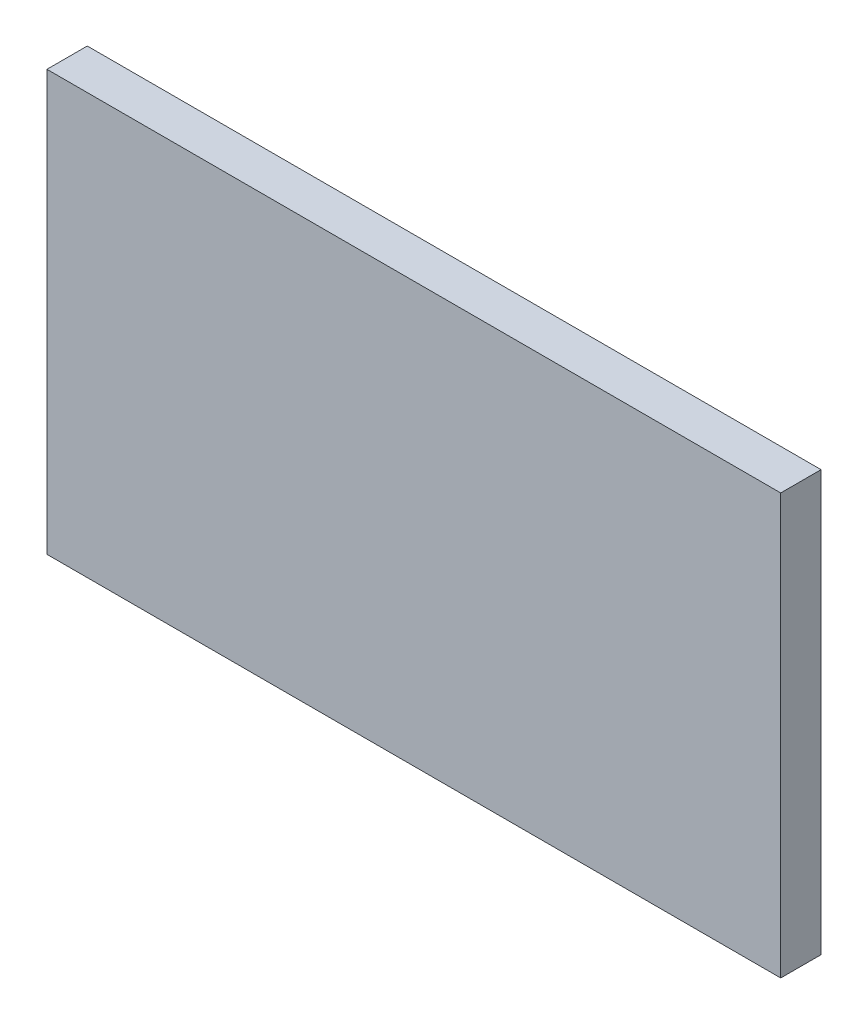
from build123d import *

# Parameters (mm, degrees)
SKETCH1_W           = 181.921942824
SKETCH1_H           = 104.149632438
BOSS_EXTRUDE1_DEPTH = 10


with BuildPart() as part:
    # Sketch1 → Boss-Extrude1 (new body)
    with BuildSketch(Plane.XY):
        Rectangle(SKETCH1_W, SKETCH1_H)
    extrude(amount=BOSS_EXTRUDE1_DEPTH)


solid = part.part
